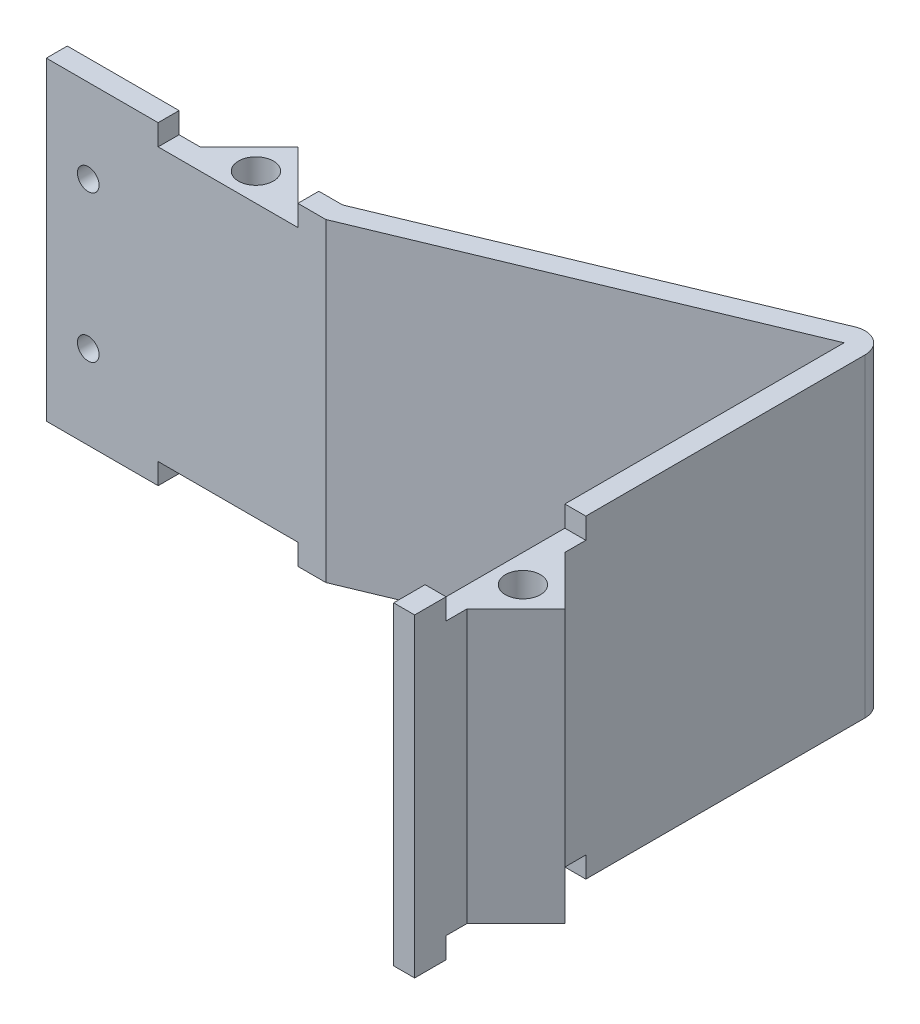
from build123d import *

# Parameters (mm, degrees)
SKETCH_1_W          = 60
SKETCH_1_H          = 45
EXTRUDE_1_DEPTH     = 3
SKETCH_2_W          = 60
SKETCH_2_H          = 3
EXTRUDE_2_DEPTH     = 3
SKETCH_3_W          = 20
SKETCH_3_H          = 3
CUT_EXTRUDE_1_DEPTH = 3
EXTRUDE_START       = -39
EXTRUDE_3_DEPTH     = 39
SKETCH_5_R          = 2.5
CUT_EXTRUDE_2_DEPTH = 74.573092908
SKETCH_6_W          = 60
SKETCH_6_H          = 3
CUT_EXTRUDE_3_DEPTH = 74.573092908
SKETCH_8_W          = 20
SKETCH_8_H          = 3
CUT_EXTRUDE_4_DEPTH = 76.325958341
EXTRUDE_4_DEPTH     = 45
EXTRUDE_5_DEPTH     = 45
SKETCH_11_W         = 20
SKETCH_11_H         = 3
CUT_EXTRUDE_5_DEPTH = 3
EXTRUDE_6_DEPTH     = 39
SKETCH_14_R         = 2.5
CUT_EXTRUDE_7_DEPTH = 120.701514193
CUT_EXTRUDE_8_REACH = 122.787
SKETCH_16_R         = 1.55


with BuildPart() as part:
    # 草图1 → 凸台-拉伸1 (new body)
    with BuildSketch(Plane.XY):
        with Locations((30, 22.5)):
            Rectangle(SKETCH_1_W, SKETCH_1_H)
    extrude(amount=EXTRUDE_1_DEPTH)

    # 草图2 → 凸台-拉伸2 (add)
    with BuildSketch(Plane.XY.offset(3)):
        with Locations((30, 40.5)):
            Rectangle(SKETCH_2_W, SKETCH_2_H)
        with Locations((30, 4.5)):
            Rectangle(SKETCH_2_W, SKETCH_2_H)
    extrude(amount=EXTRUDE_2_DEPTH)

    # 草图3 → 切除-拉伸1 (cut)
    with BuildSketch(Plane.XY.offset(3)):
        with Locations((26, 1.5)):
            Rectangle(SKETCH_3_W, SKETCH_3_H)
        with Locations((26, 43.5)):
            Rectangle(SKETCH_3_W, SKETCH_3_H)
    extrude(amount=-CUT_EXTRUDE_1_DEPTH, mode=Mode.SUBTRACT)

    # 草图4 → 凸台-拉伸3 (add)
    with BuildSketch(Plane.XZ.offset(-3).offset(EXTRUDE_START)):
        Polygon((19, 0), (26, -7), (33, 0), align=None)
    extrude(amount=EXTRUDE_3_DEPTH)

    # 草图5 → 切除-拉伸2 (cut, through all)
    with BuildSketch(Plane.XZ.offset(-3)):
        with Locations((26, -1)):
            Circle(SKETCH_5_R)
    extrude(amount=-CUT_EXTRUDE_2_DEPTH, mode=Mode.SUBTRACT)

    # 草图6 → 切除-拉伸3 (cut, through all)
    with BuildSketch(Plane.XZ.offset(-3)):
        with Locations((30, 4.5)):
            Rectangle(SKETCH_6_W, SKETCH_6_H)
    extrude(amount=-CUT_EXTRUDE_3_DEPTH, mode=Mode.SUBTRACT)

    # 草图8 → 切除-拉伸4 (cut, through all)
    with BuildSketch(Plane.XZ):
        with Locations((50, 1.5)):
            Rectangle(SKETCH_8_W, SKETCH_8_H)
    extrude(amount=-CUT_EXTRUDE_4_DEPTH, mode=Mode.SUBTRACT)

    # 草图9 → 凸台-拉伸4 (add, through all)
    with BuildSketch(Plane(origin=(0, 45, 0), x_dir=(1, 0, 0), z_dir=(0, 1, 0))):
        Polygon((40, -3), (92.37, 18.8), (91.217092711, 21.569621776), (38.847092711, -0.230378224), align=None)
    extrude(amount=-EXTRUDE_4_DEPTH)

    # 草图10 → 凸台-拉伸5 (add, through all)
    with BuildSketch(Plane(origin=(0, 45, 0), x_dir=(1, 0, 0), z_dir=(0, 1, 0))):
        with BuildLine():
            Line((92.37, 18.8), (91.217092711, 21.569621776))
            ThreePointArc((91.217092711, 21.569621776), (94.034523676, 21.295868773), (95.37, 18.8))
            Line((95.37, 18.8), (95.37, -45.66))
            Line((95.37, -45.66), (92.37, -45.66))
            Line((92.37, -45.66), (92.37, 18.8))
        make_face()
    extrude(amount=-EXTRUDE_5_DEPTH)

    # 草图11 → 切除-拉伸5 (cut)
    with BuildSketch(Plane(origin=(95.37, 0, 0), x_dir=(0, 0, -1), z_dir=(1, 0, 0))):
        with Locations((-31.16, 1.5)):
            Rectangle(SKETCH_11_W, SKETCH_11_H)
        with Locations((-31.16, 43.5)):
            Rectangle(SKETCH_11_W, SKETCH_11_H)
    extrude(amount=-CUT_EXTRUDE_5_DEPTH, mode=Mode.SUBTRACT)

    # 草图12 → 凸台-拉伸6 (add)
    with BuildSketch(Plane(origin=(0, 42, 0), x_dir=(1, 0, 0), z_dir=(0, 1, 0)).offset(EXTRUDE_START)):
        Polygon((92.37, -21.16), (102.37, -31.16), (92.37, -41.16), align=None)
    extrude(amount=EXTRUDE_6_DEPTH)

    # 草图14 → 切除-拉伸7 (cut, through all)
    with BuildSketch(Plane(origin=(0, 42, 0), x_dir=(1, 0, 0), z_dir=(0, 1, 0))):
        with Locations(Location((96.37, -31.16, 0), (0, 0, 270))):
            Circle(SKETCH_14_R)
    extrude(amount=-CUT_EXTRUDE_7_DEPTH, mode=Mode.SUBTRACT)

    # 草图16 → 切除-拉伸8 (cut, up to next)
    with BuildSketch(Plane(origin=(0, 0, 0), x_dir=(-1, 0, 0), z_dir=(0, 0, -1)), mode=Mode.PRIVATE) as cut_extrude_8_sk1:
        with Locations((-6, 33)):
            Circle(SKETCH_16_R)
    cut_extrude_8_tool1 = extrude(cut_extrude_8_sk1.sketch, amount=-CUT_EXTRUDE_8_REACH, mode=Mode.PRIVATE) & part.part
    # 草图16 → 切除-拉伸8 (cut, up to next)
    with BuildSketch(Plane(origin=(0, 0, 0), x_dir=(-1, 0, 0), z_dir=(0, 0, -1)), mode=Mode.PRIVATE) as cut_extrude_8_sk2:
        with Locations((-6, 12)):
            Circle(SKETCH_16_R)
    cut_extrude_8_tool2 = extrude(cut_extrude_8_sk2.sketch, amount=-CUT_EXTRUDE_8_REACH, mode=Mode.PRIVATE) & part.part
    add(cut_extrude_8_tool1.solids().sort_by_distance((6, 33, 0))[0], mode=Mode.SUBTRACT)
    add(cut_extrude_8_tool2.solids().sort_by_distance((6, 12, 0))[0], mode=Mode.SUBTRACT)


solid = part.part
